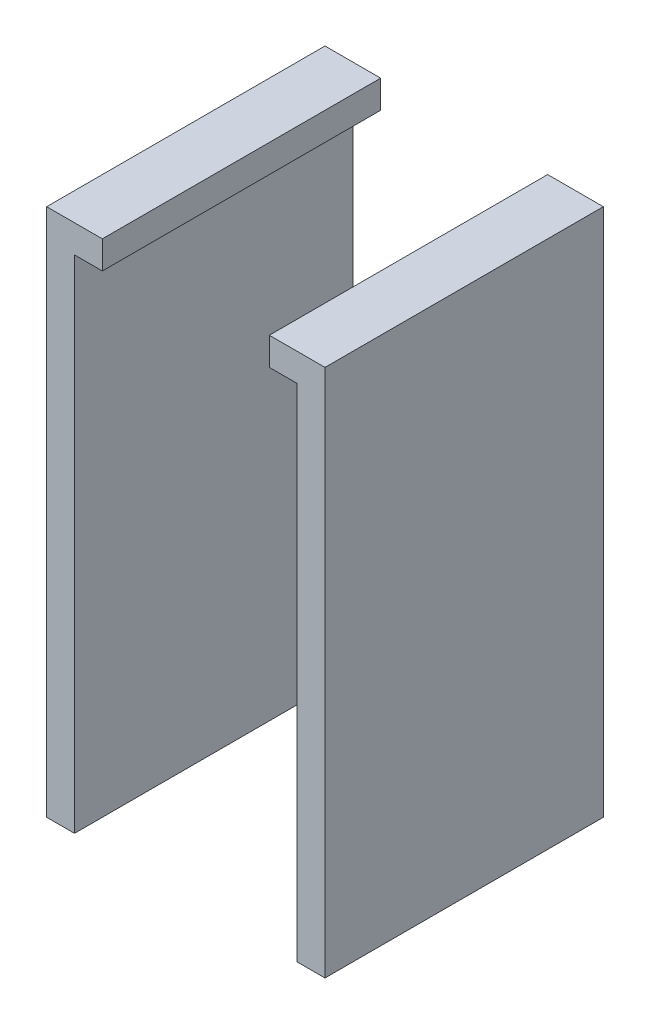
from build123d import *

# Parameters (mm, degrees)
BOSS_EXTRUDE1_DEPTH   = 150
BOSS_EXTRUDE1_2_DEPTH = 150


with BuildPart() as part:
    # Sketch1 → Boss-Extrude1 (new body)
    with BuildSketch(Plane.XY):
        Polygon((0, 0), (0, 285), (30, 285), (30, 270), (15, 270), (15, 0), align=None)
    extrude(amount=BOSS_EXTRUDE1_DEPTH)


with BuildPart() as body_2:
    # Sketch1 → Boss-Extrude1 2 (new body)
    with BuildSketch(Plane.XY):
        Polygon((135, 0), (135, 270), (120, 270), (120, 285), (150, 285), (150, 0), align=None)
    extrude(amount=BOSS_EXTRUDE1_2_DEPTH)


solid = Compound([part.part, body_2.part])
